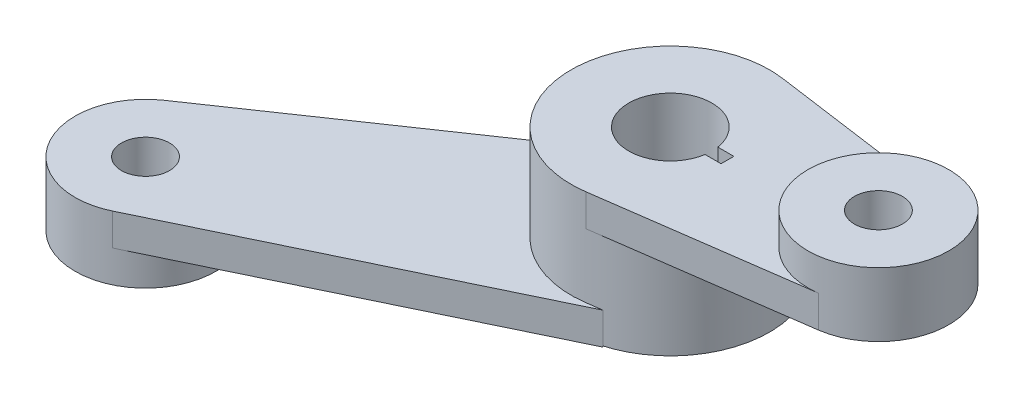
from build123d import *

# Parameters (mm, degrees)
SKETCH1_R           = 31
BOSS_EXTRUDE1_DEPTH = 40
BOSS_EXTRUDE2_START = 30
BOSS_EXTRUDE2_DEPTH = 10
BOSS_EXTRUDE3_START = 30
SKETCH1_4_R         = 7.5
BOSS_EXTRUDE3_DEPTH = 20
BOSS_EXTRUDE4_DEPTH = 10
BOSS_EXTRUDE5_START = -10
SKETCH1_6_R         = 7.5
BOSS_EXTRUDE5_DEPTH = 20


with BuildPart() as part:
    # Sketch1 → Boss-Extrude1 (new body)
    with BuildSketch(Plane(origin=(0, 0, 0), x_dir=(1, 0, 0), z_dir=(0, 1, 0))):
        Circle(SKETCH1_R)
        with BuildLine():
            Line((12.845232579, 2), (17.845232579, 2))
            Line((17.845232579, 2), (17.845232579, -2))
            Line((17.845232579, -2), (12.845232579, -2))
            ThreePointArc((12.845232579, -2), (-13, 0), (12.845232579, 2))
        make_face(mode=Mode.SUBTRACT)
    extrude(amount=BOSS_EXTRUDE1_DEPTH)

    # Sketch1<3> → Boss-Extrude2 (add)
    with BuildSketch(Plane(origin=(0, 0, 0), x_dir=(1, 0, 0), z_dir=(0, 1, 0)).offset(BOSS_EXTRUDE2_START)):
        with BuildLine():
            Line((4.292307692, -30.701402161), (9.08353603, -30.031549164))
            Line((9.08353603, -30.031549164), (68.046153846, -21.788091856))
            ThreePointArc((68.046153846, -21.788091856), (43, 0), (68.046153846, 21.788091856))
            Line((68.046153846, 21.788091856), (4.292307692, 30.701402161))
            ThreePointArc((4.292307692, 30.701402161), (23.388688916, 20.346233823), (31, 0))
            ThreePointArc((31, 0), (23.388688916, -20.346233823), (4.292307692, -30.701402161))
        make_face()
    extrude(amount=BOSS_EXTRUDE2_DEPTH)

    # Sketch1<4> → Boss-Extrude3 (add)
    with BuildSketch(Plane(origin=(0, 0, 0), x_dir=(1, 0, 0), z_dir=(0, 1, 0)).offset(BOSS_EXTRUDE3_START)):
        with BuildLine():
            ThreePointArc((68.046153846, 21.788091856), (43, 0), (68.046153846, -21.788091856))
            ThreePointArc((68.046153846, -21.788091856), (81.598424392, -14.439262713), (87, 0))
            ThreePointArc((87, 0), (81.598424392, 14.439262713), (68.046153846, 21.788091856))
        make_face()
        with Locations((65, 0)):
            Circle(SKETCH1_4_R, mode=Mode.SUBTRACT)
    extrude(amount=BOSS_EXTRUDE3_DEPTH)

    # Sketch1<5> → Boss-Extrude4 (add)
    with BuildSketch(Plane(origin=(0, 0, 0), x_dir=(1, 0, 0), z_dir=(0, 1, 0))):
        with BuildLine():
            Line((-94.382971499, -79.823897994), (9.08353603, -30.031549164))
            Line((9.08353603, -30.031549164), (4.292307692, -30.701402161))
            ThreePointArc((4.292307692, -30.701402161), (-28.915707021, -11.175056488), (-17.469853837, 25.608674447))
            Line((-17.469853837, 25.608674447), (-116.321009242, -41.826102006))
            ThreePointArc((-116.321009242, -41.826102006), (-93.645771026, -40.54807031), (-81.923048454, -60))
            ThreePointArc((-81.923048454, -60), (-85.296700275, -71.70722655), (-94.382971499, -79.823897994))
        make_face()
    extrude(amount=BOSS_EXTRUDE4_DEPTH)

    # Sketch1<6> → Boss-Extrude5 (add)
    with BuildSketch(Plane(origin=(0, 0, 0), x_dir=(1, 0, 0), z_dir=(0, 1, 0)).offset(BOSS_EXTRUDE5_START)):
        with BuildLine():
            ThreePointArc((-116.321009242, -41.826102006), (-122.975607337, -71), (-94.382971499, -79.823897994))
            ThreePointArc((-94.382971499, -79.823897994), (-85.296700275, -71.70722655), (-81.923048454, -60))
            ThreePointArc((-81.923048454, -60), (-93.645771026, -40.54807031), (-116.321009242, -41.826102006))
        make_face()
        with Locations((-103.923048454, -60)):
            Circle(SKETCH1_6_R, mode=Mode.SUBTRACT)
    extrude(amount=BOSS_EXTRUDE5_DEPTH)


solid = part.part
